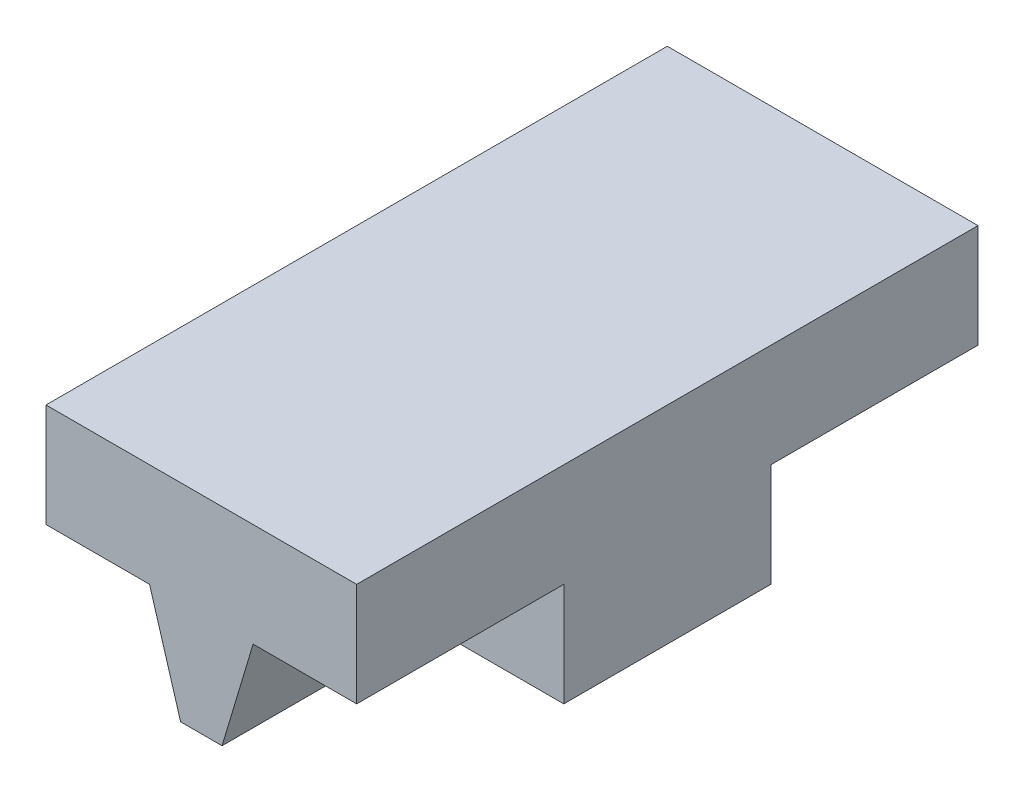
from build123d import *

# Parameters (mm, degrees)
BOSS_EXTRUDE1_DEPTH      = 150
BOSS_EXTRUDE1_DEPTH_BACK = 150
SKETCH2_W                = 600
SKETCH2_H                = 200
SKETCH3_W                = 200
SKETCH3_H                = 100
CUT_EXTRUDE1_DEPTH       = 100
SKETCH4_W                = 25
SKETCH4_H                = 25
BOSS_EXTRUDE2_DEPTH      = 5
MIRROR3_COPY_1_SKETCH_W  = 25
MIRROR3_COPY_1_SKETCH_H  = 25
MIRROR3_COPY_1_DEPTH     = 5
MIRROR3_COPY_2_SKETCH_W  = 25
MIRROR3_COPY_2_SKETCH_H  = 25
MIRROR3_COPY_2_DEPTH     = 5
CUT_EXTRUDE3_DEPTH       = 200


with BuildPart() as part:
    # Sketch2 → Boss-Extrude1 (new, two sides: drawn at the far end of the back side and taken through both)
    with BuildSketch(Plane(origin=(0, 0, 0), x_dir=(0, 0, -1), z_dir=(1, 0, 0)).offset(-BOSS_EXTRUDE1_DEPTH_BACK)):
        Rectangle(SKETCH2_W, SKETCH2_H)
    extrude(amount=BOSS_EXTRUDE1_DEPTH + BOSS_EXTRUDE1_DEPTH_BACK)

    # Sketch3 → Cut-Extrude1 (cut)
    with BuildSketch(Plane(origin=(150, 0, 0), x_dir=(0, 0, -1), z_dir=(1, 0, 0))):
        with Locations((-200, -50)):
            Rectangle(SKETCH3_W, SKETCH3_H)
        with Locations((200, -50)):
            Rectangle(SKETCH3_W, SKETCH3_H)
    cut_extrude1 = extrude(amount=-CUT_EXTRUDE1_DEPTH, mode=Mode.SUBTRACT)

    # Mirror1: Cut-Extrude1 across plane
    add(cut_extrude1.mirror(Plane(origin=(0, 0, 0), x_dir=(0, 0, 1), z_dir=(1, 0, 0))), mode=Mode.SUBTRACT)

    # Sketch4 → Boss-Extrude2 (add)
    with BuildSketch(Plane.XZ):
        with Locations((112.5, 212.5)):
            Rectangle(SKETCH4_W, SKETCH4_H)
    boss_extrude2 = extrude(amount=BOSS_EXTRUDE2_DEPTH)

    # Mirror2: Boss-Extrude2 across plane
    add(boss_extrude2.mirror(Plane(origin=(0, 0, 0), x_dir=(0, 0, 1), z_dir=(1, 0, 0))))

    # Mirror3 copy 1 sketch → Mirror3 copy 1 (add)
    with BuildSketch(Plane(origin=(0, 0, 0), x_dir=(-1, 0, 0), z_dir=(0, -1, 0))):
        with Locations((112.5, 212.5)):
            Rectangle(MIRROR3_COPY_1_SKETCH_W, MIRROR3_COPY_1_SKETCH_H)
    extrude(amount=MIRROR3_COPY_1_DEPTH)

    # Mirror3 copy 2 sketch → Mirror3 copy 2 (add)
    with BuildSketch(Plane.XZ):
        with Locations((112.5, -212.5)):
            Rectangle(MIRROR3_COPY_2_SKETCH_W, MIRROR3_COPY_2_SKETCH_H)
    extrude(amount=MIRROR3_COPY_2_DEPTH)

    # Sketch5 → Cut-Extrude3 (cut)
    with BuildSketch(Plane(origin=(0, 0, -300), x_dir=(-1, 0, 0), z_dir=(0, 0, -1))):
        Polygon((-20, -100), (-50, 0), (-50, -100), align=None)
        Polygon((50, -100), (50, 0), (20, -100), align=None)
    cut_extrude3 = extrude(amount=-CUT_EXTRUDE3_DEPTH, mode=Mode.SUBTRACT)

    # Mirror4: Cut-Extrude3 across plane
    add(cut_extrude3.mirror(Plane.XY), mode=Mode.SUBTRACT)


solid = part.part
